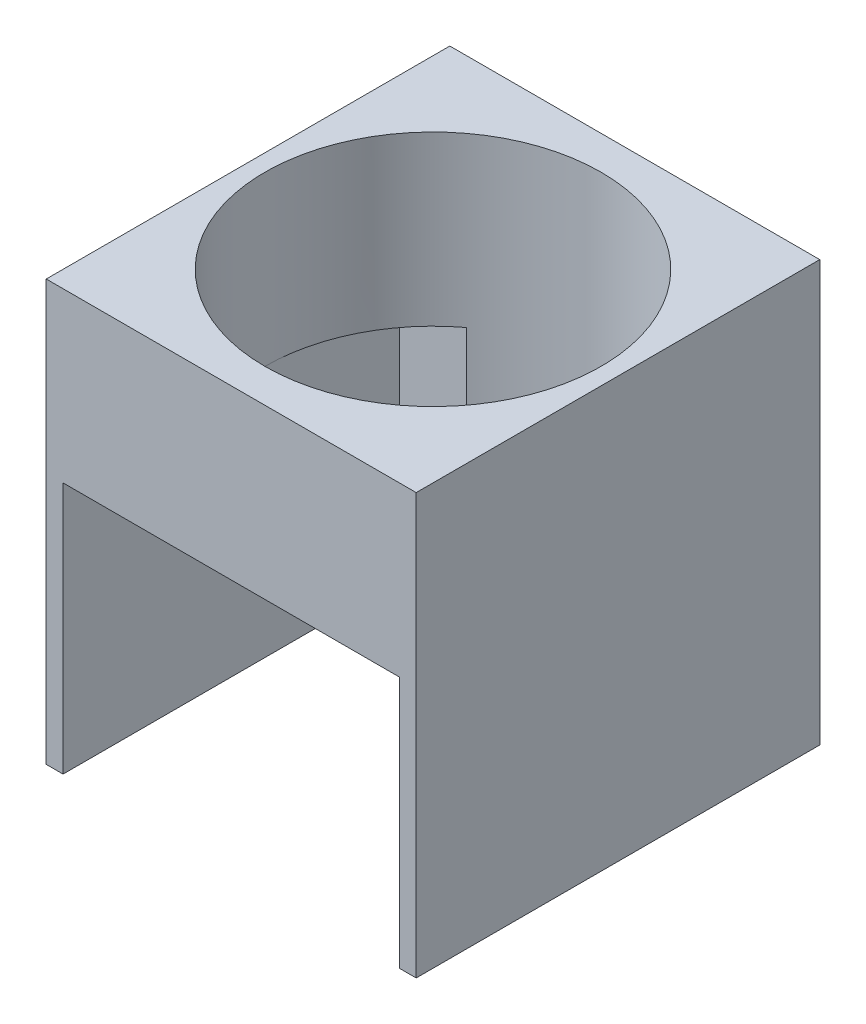
from build123d import *

# Parameters (mm, degrees)
SKETCH1_W                      = 670
SKETCH1_H                      = 120
BOSS_EXTRUDE1_DEPTH            = 530
SKETCH2_W                      = 100
SKETCH2_H                      = 200
SKETCH2_W_2                    = 650
SKETCH2_H_2                    = 250
CUT_EXTRUDE1_DEPTH             = 100
SKETCH3_R                      = 50
CUT_EXTRUDE2_DEPTH             = 260
F_12_0_12_DIAMETER_HOLE2_D     = 12
F_12_0_12_DIAMETER_HOLE2_DEPTH = 30
F_12_0_12_DIAMETER_HOLE2_TIP   = 3.605163714
SKETCH8_W                      = 650
SKETCH8_H                      = 50
BOSS_EXTRUDE2_DEPTH            = 5
SKETCH9_W                      = 10
SKETCH9_H                      = 250
CUT_EXTRUDE3_DEPTH             = 717
CUT_EXTRUDE4_DEPTH             = 5
SKETCH11_W                     = 10
SKETCH11_H                     = 100
BOSS_EXTRUDE3_DEPTH            = 78
BOSS_EXTRUDE3_2_DEPTH          = 78
BOSS_EXTRUDE3_3_DEPTH          = 78
SKETCH12_W                     = 20
SKETCH12_H                     = 30
CUT_EXTRUDE5_DEPTH             = 80
SKETCH15_W                     = 30
SKETCH15_H                     = 23.536156656
SKETCH15_H_2                   = 28.986603691
CUT_EXTRUDE7_DEPTH             = 35
SHELL1_T                       = -3
SKETCH16_W                     = 14
SKETCH16_H                     = 14
CUT_EXTRUDE8_DEPTH             = 35
SKETCH17_W                     = 5.729882812
SKETCH17_H                     = 17.428393554
SKETCH17_W_2                   = 13.369726562
SKETCH17_H_2                   = 3.342431641
BOSS_EXTRUDE4_DEPTH            = 5
SKETCH18_W                     = 670
SKETCH18_H                     = 280
CUT_EXTRUDE10_DEPTH            = 159
CUT_EXTRUDE11_DEPTH            = 863.670273187
CUT_EXTRUDE11_DEPTH_BACK       = 863.670273187
SKETCH19_W                     = 115
SKETCH19_H                     = 250
SKETCH19_W_2                   = 445
CUT_EXTRUDE12_DEPTH            = 589.153891426
CUT_EXTRUDE12_DEPTH_BACK       = 589.153891426
SKETCH20_W                     = 110
SKETCH20_H                     = 125


with BuildPart() as part:
    # Sketch1 → Boss-Extrude1 (new body)
    with BuildSketch(Plane(origin=(0, 0, 0), x_dir=(1, 0, 0), z_dir=(0, 1, 0))):
        with Locations((335, 60)):
            Rectangle(SKETCH1_W, SKETCH1_H)
    extrude(amount=BOSS_EXTRUDE1_DEPTH)

    # Sketch2 → Cut-Extrude1 (cut)
    with BuildSketch(Plane.XY):
        with Locations((60, 380)):
            Rectangle(SKETCH2_W, SKETCH2_H)
        with Locations((170, 380)):
            Rectangle(SKETCH2_W, SKETCH2_H)
        with Locations((280, 380)):
            Rectangle(SKETCH2_W, SKETCH2_H)
        with Locations((390, 380)):
            Rectangle(SKETCH2_W, SKETCH2_H)
        with Locations((500, 380)):
            Rectangle(SKETCH2_W, SKETCH2_H)
        with Locations((610, 380)):
            Rectangle(SKETCH2_W, SKETCH2_H)
        with Locations((335, 135)):
            Rectangle(SKETCH2_W_2, SKETCH2_H_2)
    extrude(amount=-CUT_EXTRUDE1_DEPTH, mode=Mode.SUBTRACT)

    # Sketch3 → Cut-Extrude2 (cut)
    with BuildSketch(Plane(origin=(0, 530, 0), x_dir=(1, 0, 0), z_dir=(0, 1, 0))):
        with Locations(Location((60, 60, 0), (0, 0, 270))):
            Circle(SKETCH3_R)
        with Locations(Location((170, 60, 0), (0, 0, 270))):
            Circle(SKETCH3_R)
        with Locations(Location((280, 60, 0), (0, 0, 270))):
            Circle(SKETCH3_R)
        with Locations(Location((390, 60, 0), (0, 0, 270))):
            Circle(SKETCH3_R)
        with Locations(Location((500, 60, 0), (0, 0, 270))):
            Circle(SKETCH3_R)
        with Locations(Location((610, 60, 0), (0, 0, 270))):
            Circle(SKETCH3_R)
    extrude(amount=-CUT_EXTRUDE2_DEPTH, mode=Mode.SUBTRACT)

    # Ø12.0 (12) Diameter Hole2
    with Locations(Plane(origin=(59.704642413, 270, -102.411697903), x_dir=(0, 0, 1), z_dir=(0, 1, 0))):
        with Locations((0, 0), (-0.195888006, 111.8520513), (0.014838595, 221.167624818), (-0.341843303, 331.364008353), (0.657723149, 441.008646429), (1.288998006, 549.811854685)):
            Hole(F_12_0_12_DIAMETER_HOLE2_D / 2, depth=F_12_0_12_DIAMETER_HOLE2_DEPTH)
            with Locations((0, 0, -(F_12_0_12_DIAMETER_HOLE2_DEPTH + F_12_0_12_DIAMETER_HOLE2_TIP / 2))):  # 118° drill point
                Cone(0, F_12_0_12_DIAMETER_HOLE2_D / 2, F_12_0_12_DIAMETER_HOLE2_TIP, mode=Mode.SUBTRACT)

    # Sketch8 → Boss-Extrude2 (add)
    with BuildSketch(Plane.XY):
        with Locations((335, 305)):
            Rectangle(SKETCH8_W, SKETCH8_H)
    extrude(amount=-BOSS_EXTRUDE2_DEPTH)

    # Sketch9 → Cut-Extrude3 (cut)
    with BuildSketch(Plane(origin=(670, 0, 0), x_dir=(0, 0, -1), z_dir=(1, 0, 0))):
        with Locations((15, 135)):
            Rectangle(SKETCH9_W, SKETCH9_H)
    extrude(amount=-CUT_EXTRUDE3_DEPTH, mode=Mode.SUBTRACT)

    # Sketch10 → Cut-Extrude4 (cut)
    with BuildSketch(Plane(origin=(0, 10, 0), x_dir=(1, 0, 0), z_dir=(0, 1, 0))):
        Polygon((365, 61.943560596), (350, 87.924322709), (320, 87.924322709), (305, 61.943560596), (320, 35.962798482), (350, 35.962798482), align=None)
    extrude(amount=-CUT_EXTRUDE4_DEPTH, mode=Mode.SUBTRACT)

    # Sketch12 → Cut-Extrude5 (cut)
    with BuildSketch(Plane.XY.offset(-100)):
        with Locations((85.198613037, 245)):
            Rectangle(SKETCH12_W, SKETCH12_H)
        with Locations((195.198613037, 245)):
            Rectangle(SKETCH12_W, SKETCH12_H)
        with Locations((305.198613037, 245)):
            Rectangle(SKETCH12_W, SKETCH12_H)
        with Locations((415.198613037, 245)):
            Rectangle(SKETCH12_W, SKETCH12_H)
        with Locations((525.198613037, 245)):
            Rectangle(SKETCH12_W, SKETCH12_H)
        with Locations((635.198613037, 245)):
            Rectangle(SKETCH12_W, SKETCH12_H)
    extrude(amount=-CUT_EXTRUDE5_DEPTH, mode=Mode.SUBTRACT)

    # Sketch17 → Boss-Extrude4 (add)
    # profile 1 of 9: a face of its own
    with BuildSketch(Plane.XY):
        with BuildLine():
            Line((527.508830928, 289.835452458), (527.508830928, 307.263846012))
            Line((527.508830928, 307.263846012), (534.861434459, 307.263846012))
            add(Edge.make_bspline(
                [(534.861434459, 307.263846012), (535.181337774, 307.258256848), (535.803061116, 307.24739446), (536.703508491, 307.139069344), (537.544992916, 306.975202489), (538.325061607, 306.737496792), (539.040841948, 306.426020155), (539.698044515, 306.051894954), (540.290333057, 305.605079277), (540.822348212, 305.090232636), (541.284521701, 304.502523111), (541.692171296, 303.852565801), (542.030284458, 303.129762281), (542.309377095, 302.341316546), (542.5243908, 301.484161689), (542.679660381, 300.560045938), (542.773357357, 299.567500804), (542.783368073, 298.883107022), (542.788518428, 298.530997273)],
                knots=[0, 0, 0, 0, 1.135059408, 2.20595691, 3.214417064, 4.174978569, 5.094187092, 5.980001006, 6.853065862, 7.720814779, 8.600404634, 9.50058483, 10.438414914, 11.426825708, 12.465239141, 13.571113463, 14.750376389, 16, 16, 16, 16], degree=3))
            add(Edge.make_bspline(
                [(542.788518428, 298.530997273), (542.781740751, 298.180151665), (542.768592871, 297.499553336), (542.676885992, 296.511518461), (542.516733301, 295.591080531), (542.296748778, 294.736450427), (542.003051046, 293.953120444), (541.654236167, 293.233205539), (541.233025793, 292.585291498), (540.753136904, 292.000029304), (540.204772188, 291.484681411), (539.587651059, 291.044279297), (538.910779309, 290.668464036), (538.169670382, 290.361903209), (537.364073889, 290.124869172), (536.495133477, 289.954199984), (535.562644449, 289.853487388), (534.920131033, 289.841584621), (534.58911581, 289.835452458)],
                knots=[0, 0, 0, 0, 1.228418252, 2.382983832, 3.470276728, 4.496757894, 5.468023682, 6.394867725, 7.292157164, 8.167372942, 9.039072913, 9.918728341, 10.815246345, 11.744296628, 12.720973084, 13.750736166, 14.841206188, 16, 16, 16, 16], degree=3))
            Line((534.58911581, 289.835452458), (527.508830928, 289.835452458))
        make_face()
        with BuildLine():
            Line((533.238713741, 291.745413395), (534.048208904, 291.745413395))
            add(Edge.make_bspline(
                [(534.048208904, 291.745413395), (534.172894012, 291.749291978), (534.413033311, 291.756761998), (534.758676231, 291.825976613), (535.075745017, 291.938271137), (535.365749176, 292.094802589), (535.623404602, 292.300450923), (535.848862806, 292.551404902), (536.04776914, 292.844737637), (536.217685755, 293.190205032), (536.364284647, 293.596533622), (536.481764702, 294.076367921), (536.592118304, 294.630928744), (536.673672739, 295.265507643), (536.740044562, 295.978448886), (536.788346679, 296.768428292), (536.812018936, 297.636801208), (536.817188964, 298.241258393), (536.819890499, 298.55711002)],
                knots=[0, 0, 0, 0, 0.728710832, 1.403472396, 2.052289494, 2.690292559, 3.321919393, 3.970736491, 4.656696891, 5.388631723, 6.217040872, 7.17856157, 8.275589967, 9.523440737, 10.918935818, 12.463926104, 14.152268318, 16, 16, 16, 16], degree=3))
            add(Edge.make_bspline(
                [(536.819890499, 298.55711002), (536.8171426, 298.871715251), (536.811863063, 299.476166083), (536.7886758, 300.343334385), (536.739579947, 301.133216935), (536.674703848, 301.843934916), (536.589660404, 302.476324031), (536.488366458, 303.031681737), (536.362441588, 303.507627045), (536.222158727, 303.914921549), (536.050140993, 304.256514038), (535.858357073, 304.554097881), (535.62547107, 304.79746827), (535.36991257, 305.004888479), (535.079348843, 305.160875844), (534.761320266, 305.273944358), (534.414185903, 305.34216807), (534.172870641, 305.349893944), (534.048208904, 305.353885075)],
                knots=[0, 0, 0, 0, 1.842836665, 3.540640921, 5.080358154, 6.47765669, 7.719902824, 8.816971715, 9.781579111, 10.601733135, 11.334613876, 12.017393917, 12.666641099, 13.29908421, 13.937911793, 14.587567384, 15.270347425, 16, 16, 16, 16], degree=3))
            Line((534.048208904, 305.353885075), (533.238713741, 305.353885075))
            Line((533.238713741, 305.353885075), (533.238713741, 291.745413395))
        make_face(mode=Mode.SUBTRACT)
    # profile 2 of 9: a face of its own
    with BuildSketch(Plane.XY):
        with Locations((547.563420772, 298.549649235)):
            Rectangle(SKETCH17_W, SKETCH17_H)
    # profile 3 of 9: a face of its own
    with BuildSketch(Plane.XY):
        Polygon((564.514324092, 307.263846012), (564.514324092, 305.115139958), (558.545696163, 305.115139958), (558.545696163, 299.862747379), (563.559343624, 299.862747379), (563.559343624, 297.714041325), (558.545696163, 297.714041325), (558.545696163, 289.835452458), (552.81581335, 289.835452458), (552.81581335, 307.263846012), align=None)
    # profile 4 of 9: a face of its own
    with BuildSketch(Plane.XY):
        Polygon((577.645305538, 307.263846012), (577.645305538, 305.115139958), (571.676677608, 305.115139958), (571.676677608, 299.862747379), (576.690325069, 299.862747379), (576.690325069, 297.714041325), (571.676677608, 297.714041325), (571.676677608, 289.835452458), (565.946794795, 289.835452458), (565.946794795, 307.263846012), align=None)
    # profile 5 of 9: a face of its own
    with BuildSketch(Plane.XY):
        with Locations((584.330168819, 287.448001286)):
            Rectangle(SKETCH17_W_2, SKETCH17_H_2)
    # profile 6 of 9: a face of its own
    with BuildSketch(Plane.XY):
        with BuildLine():
            Line((605.578484249, 307.263846012), (605.578484249, 295.602639195))
            add(Edge.make_bspline(
                [(605.578484249, 295.602639195), (605.574209777, 295.35989389), (605.565919345, 294.889083964), (605.480877158, 294.20653885), (605.349958188, 293.569747554), (605.15926554, 292.978838165), (604.911867049, 292.436847071), (604.616163877, 291.936663973), (604.260702644, 291.487723021), (603.847299908, 291.08966617), (603.386881991, 290.731670113), (602.867295001, 290.425440037), (602.293741958, 290.168488385), (601.66690529, 289.960990771), (600.988052682, 289.797299786), (600.254912883, 289.679078851), (599.467035781, 289.60781007), (598.923618241, 289.60048219), (598.643684673, 289.59670734)],
                knots=[0, 0, 0, 0, 1.108173197, 2.149326602, 3.136215123, 4.073726706, 4.978516626, 5.852185058, 6.72141202, 7.584905625, 8.467554395, 9.379216169, 10.332422268, 11.332766067, 12.390653242, 13.518530507, 14.721707419, 16, 16, 16, 16], degree=3))
            add(Edge.make_bspline(
                [(598.643684673, 289.59670734), (598.373688491, 289.600411437), (597.851346557, 289.607577482), (597.093280473, 289.679448684), (596.387523889, 289.797736542), (595.733050135, 289.960122315), (595.130189942, 290.169220301), (594.579048171, 290.42623041), (594.078350789, 290.732835498), (593.633858028, 291.090104794), (593.234289459, 291.486851767), (592.899913678, 291.940746827), (592.609043638, 292.435866034), (592.375223767, 292.980322997), (592.191754821, 293.570441519), (592.063541006, 294.20666921), (591.983676196, 294.889343196), (591.974661767, 295.359932437), (591.970012569, 295.602639195)],
                knots=[0, 0, 0, 0, 1.258901956, 2.435505865, 3.547148904, 4.59359074, 5.576649289, 6.5183682, 7.424469602, 8.307507093, 9.172751023, 10.042627298, 10.928839176, 11.845659241, 12.799442865, 13.80597989, 14.868432463, 16, 16, 16, 16], degree=3))
            Line((591.970012569, 295.602639195), (591.970012569, 307.263846012))
            Line((591.970012569, 307.263846012), (597.699895381, 307.263846012))
            Line((597.699895381, 307.263846012), (597.699895381, 295.457153889))
            add(Edge.make_bspline(
                [(597.699895381, 295.457153889), (597.700816195, 295.287996189), (597.702584578, 294.963135903), (597.729908723, 294.499051493), (597.768241004, 294.079064133), (597.828226169, 293.705517832), (597.90066041, 293.377063412), (597.989882091, 293.09281535), (598.094998068, 292.852496478), (598.225239063, 292.654232043), (598.380826623, 292.495135011), (598.55368342, 292.353231761), (598.757556996, 292.238543846), (598.987648905, 292.146224908), (599.243380948, 292.070549638), (599.526120553, 292.020376099), (599.83553351, 291.990763905), (600.049971942, 291.986424568), (600.161954402, 291.984158512)],
                knots=[0, 0, 0, 0, 1.622370975, 3.115695595, 4.458049099, 5.666011203, 6.742434742, 7.681714947, 8.519814998, 9.250928664, 9.942747364, 10.646898194, 11.389596108, 12.175933929, 13.021386247, 13.943159715, 14.925891993, 16, 16, 16, 16], degree=3))
            add(Edge.make_bspline(
                [(600.161954402, 291.984158512), (600.283927219, 291.987190593), (600.521124756, 291.993087005), (600.86597014, 292.03390861), (601.187714881, 292.103380086), (601.484890424, 292.205377303), (601.758665297, 292.332852529), (602.012761516, 292.484567923), (602.236391413, 292.674631152), (602.439076761, 292.888441291), (602.620738276, 293.128529789), (602.771757722, 293.399928575), (602.905501548, 293.697121508), (603.005823683, 294.025060118), (603.089837826, 294.379999499), (603.146989706, 294.763086929), (603.186210275, 295.174074524), (603.189394751, 295.457053988), (603.191033077, 295.602639195)],
                knots=[0, 0, 0, 0, 1.083870311, 2.107775948, 3.08105344, 4.003637981, 4.893545291, 5.761570557, 6.624657808, 7.49233129, 8.376387281, 9.291996285, 10.246843261, 11.267344133, 12.334180325, 13.486053461, 14.706643157, 16, 16, 16, 16], degree=3))
            Line((603.191033077, 295.602639195), (603.191033077, 307.263846012))
            Line((603.191033077, 307.263846012), (605.578484249, 307.263846012))
        make_face()
    # profile 7 of 9: a face of its own
    with BuildSketch(Plane.XY):
        with BuildLine():
            Line((619.731593227, 302.015183827), (616.739818477, 301.526502415))
            add(Edge.make_bspline(
                [(616.739818477, 301.526502415), (616.748849224, 301.670726223), (616.765660669, 301.939210177), (616.78429066, 302.312269209), (616.796668381, 302.625642376), (616.798628236, 302.814722915), (616.799504756, 302.899286839)],
                knots=[0, 0, 0, 0, 1.261802504, 2.348944521, 3.261585937, 4, 4, 4, 4], degree=3))
            add(Edge.make_bspline(
                [(616.799504756, 302.899286839), (616.798306068, 303.007660677), (616.795968139, 303.219033721), (616.750451916, 303.523894877), (616.694806916, 303.811547356), (616.604352699, 304.076787391), (616.488181329, 304.320314265), (616.348943917, 304.543955606), (616.184187178, 304.745078709), (615.995833421, 304.928129987), (615.778009957, 305.083200131), (615.536269472, 305.218702836), (615.269765326, 305.333844758), (614.978065514, 305.431346685), (614.660683072, 305.504624438), (614.319025281, 305.556776695), (613.952471696, 305.585673441), (613.699597795, 305.590260771), (613.568984889, 305.592630192)],
                knots=[0, 0, 0, 0, 1.079280541, 2.105035848, 3.067950317, 3.99715044, 4.889989748, 5.753421302, 6.617030865, 7.476358039, 8.364190572, 9.274590025, 10.235106994, 11.254473582, 12.337095886, 13.478601727, 14.697662529, 16, 16, 16, 16], degree=3))
            add(Edge.make_bspline(
                [(613.568984889, 305.592630192), (613.391954632, 305.58912286), (613.059112606, 305.582528579), (612.595688488, 305.495339748), (612.198743126, 305.361419257), (611.87165349, 305.163811893), (611.613188167, 304.909795747), (611.433841092, 304.593316589), (611.323009072, 304.224665915), (611.313400221, 303.959558324), (611.308367061, 303.820693775)],
                knots=[0, 0, 0, 0, 1.294917039, 2.43462794, 3.440028966, 4.347597256, 5.210608309, 6.06356377, 6.985685997, 8, 8, 8, 8], degree=3))
            add(Edge.make_bspline(
                [(611.308367061, 303.820693775), (611.317562032, 303.705133219), (611.336106628, 303.472068433), (611.47315858, 303.132808312), (611.695999602, 302.811560885), (612.009295906, 302.510664216), (612.404107796, 302.221967273), (612.884407504, 301.948533431), (613.450813789, 301.688189695), (613.862519081, 301.536023727), (614.080048656, 301.455624958)],
                knots=[0, 0, 0, 0, 0.716839541, 1.445735977, 2.240793036, 3.131329288, 4.131129903, 5.273471266, 6.559404876, 8, 8, 8, 8], degree=3))
            add(Edge.make_bspline(
                [(614.080048656, 301.455624958), (614.335934702, 301.364918412), (614.834564244, 301.188164095), (615.547657928, 300.88707802), (616.213068388, 300.5749594), (616.829579094, 300.246613346), (617.397833174, 299.90520698), (617.914851624, 299.544556457), (618.386199073, 299.173962102), (618.807001026, 298.783874588), (619.177995113, 298.378100064), (619.4958685, 297.952745357), (619.771807525, 297.51723103), (619.991113975, 297.061458502), (620.169645242, 296.594624218), (620.292698657, 296.11024444), (620.364288243, 295.609761088), (620.37516617, 295.270864226), (620.380681514, 295.099036213)],
                knots=[0, 0, 0, 0, 1.359488612, 2.649152603, 3.874964776, 5.039588756, 6.146130126, 7.193090393, 8.194917302, 9.146793662, 10.063845301, 10.944476293, 11.803344532, 12.641736646, 13.473440096, 14.302714936, 15.139439897, 16, 16, 16, 16], degree=3))
            add(Edge.make_bspline(
                [(620.380681514, 295.099036213), (620.374476075, 294.902306495), (620.362285176, 294.515820995), (620.280160209, 293.948630617), (620.138011896, 293.409496554), (619.938489338, 292.895972278), (619.681049879, 292.411946655), (619.366518754, 291.954381076), (618.996510229, 291.525099427), (618.5710008, 291.128381035), (618.102222518, 290.765302239), (617.587803957, 290.450854345), (617.034458515, 290.187092261), (616.444107988, 289.968993032), (615.81453624, 289.801373099), (615.145337453, 289.685291013), (614.438790193, 289.606619894), (613.954683001, 289.600062276), (613.70700941, 289.59670734)],
                knots=[0, 0, 0, 0, 0.972121714, 1.909782367, 2.824924061, 3.721832975, 4.62620438, 5.527836938, 6.46026819, 7.421000932, 8.398101015, 9.385579713, 10.394244048, 11.422703992, 12.491421888, 13.608778581, 14.776629625, 16, 16, 16, 16], degree=3))
            add(Edge.make_bspline(
                [(613.70700941, 289.59670734), (613.445745367, 289.599650312), (612.939893069, 289.605348413), (612.207608113, 289.66709241), (611.525297432, 289.760984454), (610.893395078, 289.899706116), (610.309273131, 290.072394336), (609.776099392, 290.288320955), (609.295310255, 290.547303481), (608.863217672, 290.843007892), (608.478306623, 291.175775461), (608.148120946, 291.551766865), (607.86942369, 291.967163224), (607.639947144, 292.421521488), (607.466477665, 292.917583541), (607.339164663, 293.449829748), (607.264537999, 294.021332449), (607.254747521, 294.414908557), (607.249700069, 294.617815586)],
                knots=[0, 0, 0, 0, 1.342201143, 2.598733168, 3.773451092, 4.878874364, 5.91991243, 6.900006476, 7.829142054, 8.72062616, 9.585588575, 10.436728592, 11.283829734, 12.149664931, 13.044964919, 13.977937424, 14.957531465, 16, 16, 16, 16], degree=3))
            add(Edge.make_bspline(
                [(607.249700069, 294.617815586), (607.250803815, 294.692425759), (607.253213998, 294.855347393), (607.260452266, 295.122772538), (607.275636683, 295.433682216), (607.29037174, 295.656130545), (607.298195171, 295.774237248)],
                knots=[0, 0, 0, 0, 0.773500207, 1.689044709, 2.77302154, 4, 4, 4, 4], degree=3))
            Line((607.298195171, 295.774237248), (610.36457777, 296.337526509))
            add(Edge.make_bspline(
                [(610.36457777, 296.337526509), (610.326952988, 296.136337493), (610.255606535, 295.754830366), (610.178678473, 295.21219969), (610.124206629, 294.733311493), (610.11767002, 294.435147371), (610.114641475, 294.297001835)],
                knots=[0, 0, 0, 0, 1.192988372, 2.262218769, 3.194850416, 4, 4, 4, 4], degree=3))
            add(Edge.make_bspline(
                [(610.114641475, 294.297001835), (610.116191817, 294.183708768), (610.119182568, 293.965156219), (610.159053378, 293.648552813), (610.215988606, 293.352999663), (610.302906772, 293.079707227), (610.411206928, 292.826307836), (610.544682453, 292.59538211), (610.704385489, 292.386485019), (610.887496571, 292.200099922), (611.094689168, 292.033628705), (611.327456494, 291.892756696), (611.58347653, 291.771733922), (611.864681562, 291.677479524), (612.167961721, 291.596080628), (612.497219749, 291.548235723), (612.849461228, 291.512043782), (613.092629543, 291.508500084), (613.218327999, 291.506668278)],
                knots=[0, 0, 0, 0, 1.135776692, 2.191015738, 3.19649269, 4.151244236, 5.061952528, 5.956281389, 6.819534407, 7.692823504, 8.571441916, 9.478554956, 10.416037156, 11.406231466, 12.450054172, 13.561596327, 14.739541482, 16, 16, 16, 16], degree=3))
            add(Edge.make_bspline(
                [(613.218327999, 291.506668278), (613.423996012, 291.510791273), (613.810619321, 291.518541853), (614.349272542, 291.616708407), (614.810575885, 291.768742445), (615.189785268, 291.991387532), (615.490778961, 292.278756613), (615.698005174, 292.637320004), (615.824813318, 293.05638326), (615.837728413, 293.355975238), (615.844524288, 293.513619419)],
                knots=[0, 0, 0, 0, 1.308765556, 2.460272085, 3.475015317, 4.388076298, 5.239673503, 6.095681635, 6.997954785, 8, 8, 8, 8], degree=3))
            add(Edge.make_bspline(
                [(615.844524288, 293.513619419), (615.833808824, 293.638242951), (615.811807312, 293.894126055), (615.644884004, 294.264515838), (615.382382362, 294.620631473), (615.016807277, 294.962984909), (614.551376589, 295.293471235), (613.986957743, 295.616730224), (613.322148235, 295.933112033), (612.83677959, 296.119639164), (612.580430889, 296.21815395)],
                knots=[0, 0, 0, 0, 0.667930748, 1.371427933, 2.146459016, 3.034714139, 4.04893387, 5.207327294, 6.525042705, 8, 8, 8, 8], degree=3))
            add(Edge.make_bspline(
                [(612.580430889, 296.21815395), (612.374354345, 296.29679374), (611.970646869, 296.450850434), (611.394079385, 296.713586304), (610.853066711, 296.987016804), (610.357486361, 297.288235735), (609.896382561, 297.599610528), (609.477036946, 297.932256792), (609.09841673, 298.284556341), (608.758710772, 298.653375077), (608.457302107, 299.038989264), (608.199448649, 299.444659231), (607.977533299, 299.866789834), (607.798609588, 300.308107488), (607.65975715, 300.767821241), (607.559616231, 301.244439392), (607.497905054, 301.739995674), (607.491630423, 302.075933546), (607.488445186, 302.246468159)],
                knots=[0, 0, 0, 0, 1.249558333, 2.447906163, 3.58867143, 4.682264114, 5.731748367, 6.739728761, 7.711906036, 8.659384707, 9.578321416, 10.481344598, 11.379544271, 12.277135726, 13.175418307, 14.097160112, 15.034047388, 16, 16, 16, 16], degree=3))
            add(Edge.make_bspline(
                [(607.488445186, 302.246468159), (607.49282555, 302.439538736), (607.501402184, 302.817565692), (607.587451154, 303.36980586), (607.719291893, 303.894921371), (607.910558542, 304.389343064), (608.156192894, 304.852853762), (608.453187669, 305.288766511), (608.804241719, 305.697593471), (609.213503754, 306.066686531), (609.657214714, 306.407618241), (610.14376173, 306.697651931), (610.658716537, 306.950861947), (611.210636666, 307.148827868), (611.791820619, 307.313252612), (612.408080529, 307.421140415), (613.056315391, 307.490701612), (613.499160755, 307.498567824), (613.725661373, 307.502591129)],
                knots=[0, 0, 0, 0, 1.01033566, 1.978209831, 2.919499157, 3.840961976, 4.746855014, 5.660740114, 6.597989116, 7.56120833, 8.541877795, 9.523498025, 10.522416858, 11.542172371, 12.589598349, 13.681636521, 14.814234488, 16, 16, 16, 16], degree=3))
            add(Edge.make_bspline(
                [(613.725661373, 307.502591129), (613.968269855, 307.498219033), (614.438190994, 307.489750488), (615.120391152, 307.426787419), (615.755073228, 307.319142339), (616.345153155, 307.171557286), (616.887304575, 306.977590666), (617.384933999, 306.742393454), (617.834452216, 306.46201507), (618.236961315, 306.139451502), (618.593086714, 305.773322851), (618.897467704, 305.361641069), (619.158701245, 304.909408454), (619.366684143, 304.412232174), (619.529870326, 303.873247147), (619.649133834, 303.29158184), (619.720420497, 302.667301443), (619.72779778, 302.236712324), (619.731593227, 302.015183827)],
                knots=[0, 0, 0, 0, 1.248314423, 2.417925914, 3.521398822, 4.558068205, 5.543720209, 6.479599284, 7.385061127, 8.263440163, 9.127722873, 10.00561236, 10.891325273, 11.808802823, 12.772251995, 13.784947978, 14.860405143, 16, 16, 16, 16], degree=3))
        make_face()
    # profile 8 of 9: a face of its own
    with BuildSketch(Plane.XY):
        Polygon((633.989153194, 307.263846012), (633.989153194, 305.115139958), (628.020525264, 305.115139958), (628.020525264, 300.340237614), (633.034172725, 300.340237614), (633.034172725, 298.191531559), (628.020525264, 298.191531559), (628.020525264, 291.984158512), (634.944133663, 291.984158512), (634.944133663, 289.835452458), (622.290642452, 289.835452458), (622.290642452, 307.263846012), align=None)
    # profile 9 of 9: a face of its own
    with BuildSketch(Plane.XY):
        with BuildLine():
            Line((636.376604366, 289.835452458), (636.376604366, 307.263846012))
            Line((636.376604366, 307.263846012), (643.990335369, 307.263846012))
            add(Edge.make_bspline(
                [(643.990335369, 307.263846012), (644.237946498, 307.261150834), (644.721600887, 307.25588639), (645.426490561, 307.189203683), (646.094808274, 307.090496236), (646.724915796, 306.949857504), (647.317873659, 306.767252686), (647.871119087, 306.542146), (648.390701058, 306.282329135), (648.864494846, 305.976472528), (649.295093616, 305.642889252), (649.669668547, 305.279483604), (649.990389523, 304.894749072), (650.250664962, 304.483256345), (650.454275633, 304.048690948), (650.59581384, 303.587791605), (650.684089268, 303.104102537), (650.695510601, 302.772834174), (650.701311397, 302.604585835)],
                knots=[0, 0, 0, 0, 1.303269877, 2.545653735, 3.724355284, 4.8584284, 5.941462088, 6.987020715, 8.000098032, 8.995332524, 9.951400474, 10.863507538, 11.737823931, 12.582415999, 13.420128714, 14.25671499, 15.114600608, 16, 16, 16, 16], degree=3))
            add(Edge.make_bspline(
                [(650.701311397, 302.604585835), (650.698282873, 302.472674957), (650.692382063, 302.215658276), (650.651041486, 301.838684287), (650.580643818, 301.480313933), (650.481036683, 301.139915259), (650.347814833, 300.820175594), (650.191279492, 300.517863507), (650.009772227, 300.230553342), (649.788675198, 299.970497982), (649.548268341, 299.722842359), (649.274558803, 299.497116911), (648.974487035, 299.288655528), (648.642526299, 299.104010513), (648.287619671, 298.928055749), (647.899038177, 298.784921972), (647.486819978, 298.644749395), (647.19793098, 298.577036306), (647.049257183, 298.54218845)],
                knots=[0, 0, 0, 0, 1.057156483, 2.059775939, 3.035078039, 3.981068617, 4.897189472, 5.80650904, 6.70770952, 7.613691521, 8.536886357, 9.470937334, 10.45233069, 11.461024139, 12.51295332, 13.623444893, 14.776929983, 16, 16, 16, 16], degree=3))
            add(Edge.make_bspline(
                [(647.049257183, 298.54218845), (647.19164695, 298.499279419), (647.467865022, 298.416041346), (647.856360945, 298.265600017), (648.211652989, 298.111536308), (648.524185739, 297.936781388), (648.807636894, 297.762122504), (649.047122259, 297.564301324), (649.255235567, 297.361673563), (649.425188343, 297.135464734), (649.570253643, 296.882344437), (649.694827156, 296.586596707), (649.815179167, 296.247423665), (649.917667348, 295.859098311), (650.004750555, 295.423699276), (650.088222437, 294.944027189), (650.153853601, 294.416024546), (650.187587341, 294.048412906), (650.2051692, 293.856815525)],
                knots=[0, 0, 0, 0, 1.149282524, 2.229462177, 3.219229774, 4.139917433, 4.995948464, 5.788695735, 6.536448429, 7.236319808, 7.968460079, 8.78645307, 9.713791991, 10.749194692, 11.887975363, 13.146018663, 14.512518948, 16, 16, 16, 16], degree=3))
            add(Edge.make_bspline(
                [(650.2051692, 293.856815525), (650.225980287, 293.627849833), (650.265975604, 293.187817268), (650.348933081, 292.554613589), (650.44386163, 291.974357025), (650.555874504, 291.44528724), (650.681301216, 290.967898855), (650.821280597, 290.540469593), (650.979920039, 290.165788217), (651.10484481, 289.941461656), (651.163880062, 289.835452458)],
                knots=[0, 0, 0, 0, 1.324580516, 2.545615266, 3.678710841, 4.711533017, 5.660403917, 6.521349952, 7.301239649, 8, 8, 8, 8], degree=3))
            Line((651.163880062, 289.835452458), (645.213904094, 289.835452458))
            add(Edge.make_bspline(
                [(645.213904094, 289.835452458), (645.12229736, 290.069847279), (644.935171241, 290.548648246), (644.7595281, 291.319414791), (644.64846922, 292.142514735), (644.635117598, 292.70994511), (644.628232479, 293.002555653)],
                knots=[0, 0, 0, 0, 0.930410518, 1.900560147, 2.917368081, 4, 4, 4, 4], degree=3))
            Line((644.628232479, 293.002555653), (644.605850124, 294.002300831))
            Line((644.605850124, 294.002300831), (644.579737377, 295.266903874))
            add(Edge.make_bspline(
                [(644.579737377, 295.266903874), (644.573694669, 295.477395004), (644.562357007, 295.872330118), (644.469348432, 296.426164013), (644.30178735, 296.894645884), (644.073222546, 297.287223005), (643.766741442, 297.590613479), (643.39104803, 297.804152917), (642.950456912, 297.93396284), (642.634664848, 297.946292392), (642.468335247, 297.952786442)],
                knots=[0, 0, 0, 0, 1.295300309, 2.430314163, 3.439929415, 4.342995669, 5.203512789, 6.060756153, 6.978588463, 8, 8, 8, 8], degree=3))
            Line((642.468335247, 297.952786442), (642.106487178, 297.952786442))
            Line((642.106487178, 297.952786442), (642.106487178, 289.835452458))
            Line((642.106487178, 289.835452458), (636.376604366, 289.835452458))
        make_face()
        with BuildLine():
            Line((642.106487178, 299.862747379), (642.617550945, 299.862747379))
            add(Edge.make_bspline(
                [(642.617550945, 299.862747379), (642.722054451, 299.865172716), (642.925280724, 299.869889229), (643.220054897, 299.898289891), (643.494111408, 299.951809873), (643.749840966, 300.021017819), (643.984372137, 300.114851792), (644.200147241, 300.225818296), (644.391160406, 300.362685327), (644.565327067, 300.516342321), (644.718148635, 300.691986294), (644.850351299, 300.889034217), (644.961199162, 301.106225057), (645.056078491, 301.342818683), (645.125883912, 301.600830857), (645.173262731, 301.879472914), (645.203404658, 302.177423605), (645.207875435, 302.383174491), (645.210173702, 302.488943669)],
                knots=[0, 0, 0, 0, 1.184986479, 2.304423995, 3.352332712, 4.347714965, 5.303263624, 6.211353909, 7.091434645, 7.960150225, 8.839440182, 9.723126897, 10.64371617, 11.599264829, 12.608232147, 13.667459739, 14.800924404, 16, 16, 16, 16], degree=3))
            add(Edge.make_bspline(
                [(645.210173702, 302.488943669), (645.207875435, 302.594712847), (645.203404658, 302.800463732), (645.173262731, 303.098414423), (645.125883912, 303.37705648), (645.056078491, 303.635068654), (644.961199162, 303.87166228), (644.850351299, 304.08885312), (644.718148635, 304.285901043), (644.565327067, 304.461545017), (644.391160406, 304.61520201), (644.200147241, 304.752069041), (643.984372137, 304.863035546), (643.749840966, 304.956869518), (643.494111408, 305.026077464), (643.220054897, 305.079597446), (642.925280724, 305.107998108), (642.722054451, 305.112714621), (642.617550945, 305.115139958)],
                knots=[0, 0, 0, 0, 1.199075596, 2.332540261, 3.391767853, 4.400735171, 5.35628383, 6.276873103, 7.160559818, 8.039849775, 8.908565355, 9.788646091, 10.696736376, 11.652285035, 12.647667288, 13.695576005, 14.815013521, 16, 16, 16, 16], degree=3))
            Line((642.617550945, 305.115139958), (642.106487178, 305.115139958))
            Line((642.106487178, 305.115139958), (642.106487178, 299.862747379))
        make_face(mode=Mode.SUBTRACT)
    extrude(amount=BOSS_EXTRUDE4_DEPTH)


with BuildPart() as body_2:
    # Sketch11 → Boss-Extrude3 (new body)
    with BuildSketch(Plane.XY.offset(-100)):
        with Locations((255, 60)):
            Rectangle(SKETCH11_W, SKETCH11_H)
    extrude(amount=BOSS_EXTRUDE3_DEPTH)


with BuildPart() as body_3:
    # Sketch11 → Boss-Extrude3 2 (new body)
    with BuildSketch(Plane.XY.offset(-100)):
        with Locations((415, 60)):
            Rectangle(SKETCH11_W, SKETCH11_H)
    extrude(amount=BOSS_EXTRUDE3_2_DEPTH)


with BuildPart() as body_4:
    # Sketch11 → Boss-Extrude3 3 (new body)
    with BuildSketch(Plane.XY.offset(-100)):
        Polygon((25, 198.45686471), (325, 145.558770497), (325, 122.01775856), (345, 122.01775856), (345, 145.558770497), (645, 198.45686471), align=None)
    extrude(amount=BOSS_EXTRUDE3_3_DEPTH)

    # Sketch15 → Cut-Extrude7 (cut)
    with BuildSketch(Plane(origin=(345, 0, 0), x_dir=(0, 0, -1), z_dir=(1, 0, 0))):
        with Locations((35, 133.231921672)):
            Rectangle(SKETCH15_W, SKETCH15_H)
        with Locations((85, 130.506698154)):
            Rectangle(SKETCH15_W, SKETCH15_H_2)
    extrude(amount=-CUT_EXTRUDE7_DEPTH, mode=Mode.SUBTRACT)

    # Shell1
    shell1_openings = [body_4.faces().sort_by_distance(p)[0] for p in [
        (335, 198.45686471, -61),
    ]]
    offset(amount=SHELL1_T, openings=shell1_openings, kind=Kind.INTERSECTION)

    # Sketch16 → Cut-Extrude8 (cut)
    with BuildSketch(Plane.XZ.offset(-122.01775856)):
        with Locations((335, -60)):
            Rectangle(SKETCH16_W, SKETCH16_H)
    extrude(amount=-CUT_EXTRUDE8_DEPTH, mode=Mode.SUBTRACT)


with BuildPart() as cut_extrude10_tool:
    # Sketch18 → Cut-Extrude10 (new body)
    with BuildSketch(Plane.XY):
        with Locations((335, 140)):
            Rectangle(SKETCH18_W, SKETCH18_H)
    extrude(amount=-CUT_EXTRUDE10_DEPTH)


with BuildPart() as part_1:
    add(part.part)

    # Cut-Extrude10: cut by cut_extrude10_tool
    add(cut_extrude10_tool.part, mode=Mode.SUBTRACT)

    # Sketch19 → Cut-Extrude11 (cut, two sides: drawn at the far end of the back side and taken through both)
    with BuildSketch(Plane.XY.offset(-CUT_EXTRUDE11_DEPTH_BACK)):
        with Locations((57.5, 405)):
            Rectangle(SKETCH19_W, SKETCH19_H)
        with Locations((447.5, 405)):
            Rectangle(SKETCH19_W_2, SKETCH19_H)
    extrude(amount=CUT_EXTRUDE11_DEPTH + CUT_EXTRUDE11_DEPTH_BACK, mode=Mode.SUBTRACT)

    # Sketch20 → Cut-Extrude12 (cut, two sides: drawn at the far end of the back side and taken through both)
    with BuildSketch(Plane.XY.offset(-CUT_EXTRUDE12_DEPTH_BACK)):
        with Locations((170, 342.5)):
            Rectangle(SKETCH20_W, SKETCH20_H)
    extrude(amount=CUT_EXTRUDE12_DEPTH + CUT_EXTRUDE12_DEPTH_BACK, mode=Mode.SUBTRACT)


with BuildPart() as body_2_1:
    add(body_2.part)

    # Cut-Extrude10: cut by cut_extrude10_tool
    add(cut_extrude10_tool.part, mode=Mode.SUBTRACT)


with BuildPart() as body_3_1:
    add(body_3.part)

    # Cut-Extrude10: cut by cut_extrude10_tool
    add(cut_extrude10_tool.part, mode=Mode.SUBTRACT)


with BuildPart() as body_4_1:
    add(body_4.part)

    # Cut-Extrude10: cut by cut_extrude10_tool
    add(cut_extrude10_tool.part, mode=Mode.SUBTRACT)


solid = part_1.part
